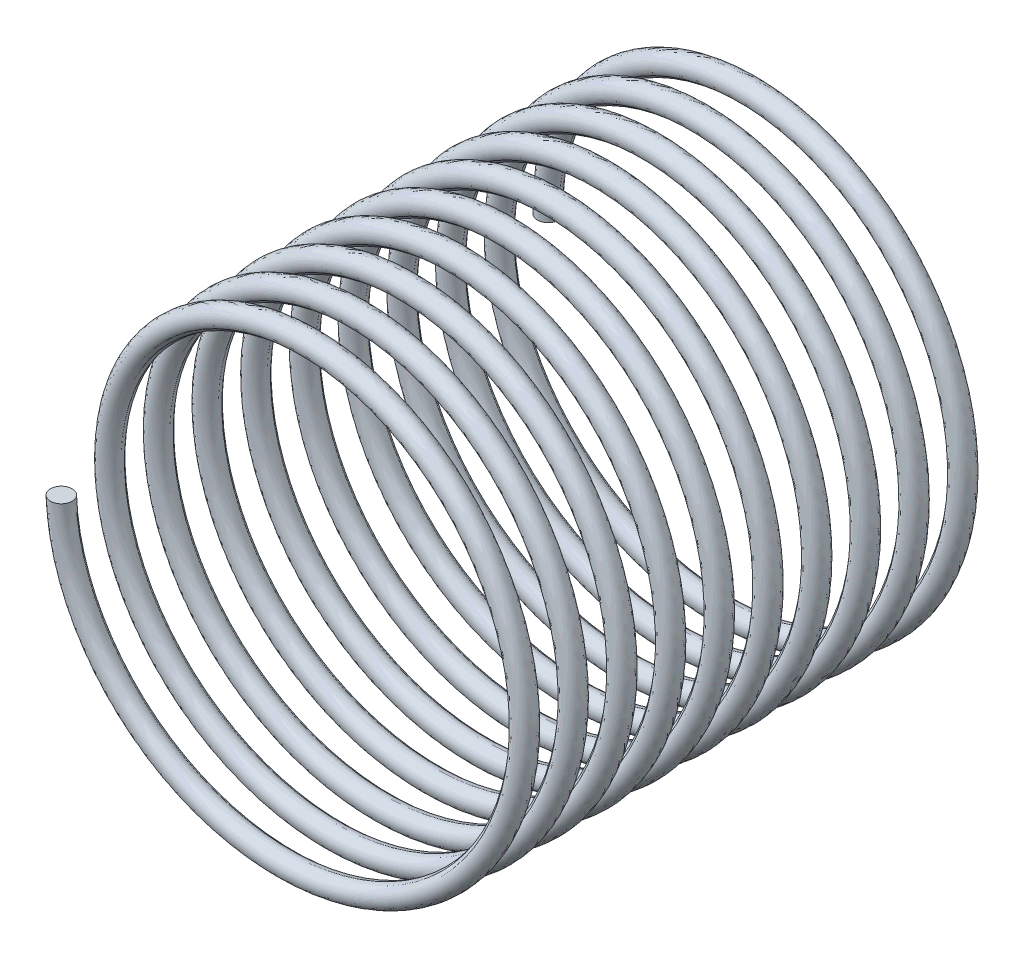
from build123d import *

# Parameters (mm, degrees)
SWEEP1_PITCH       = 22.45
SWEEP1_HEIGHT      = 224.5
SWEEP1_RADIUS      = 105
SWEEP1_START_ANGLE = -180
SKETCH2_R          = 4.987109949


with BuildPart() as part:
    # Sweep1: sweep along a helix
    with BuildLine() as sweep1_path:
        add(Helix(SWEEP1_PITCH, SWEEP1_HEIGHT, SWEEP1_RADIUS, center=(0, 0, 0), direction=(0, 0, 1), lefthand=True, mode=Mode.PRIVATE).rotate(Axis((0, 0, 0), (0, 0, 1)), SWEEP1_START_ANGLE))
    # Sketch2 → Sweep1 (sweep)
    with BuildSketch(Plane(origin=(0, 0, 0), x_dir=(1, 0, 0), z_dir=(0, 1, 0))):
        with Locations((-101.135716923, -223.527627637)):
            Circle(SKETCH2_R)
    sweep(path=sweep1_path.line, is_frenet=True)


solid = part.part
